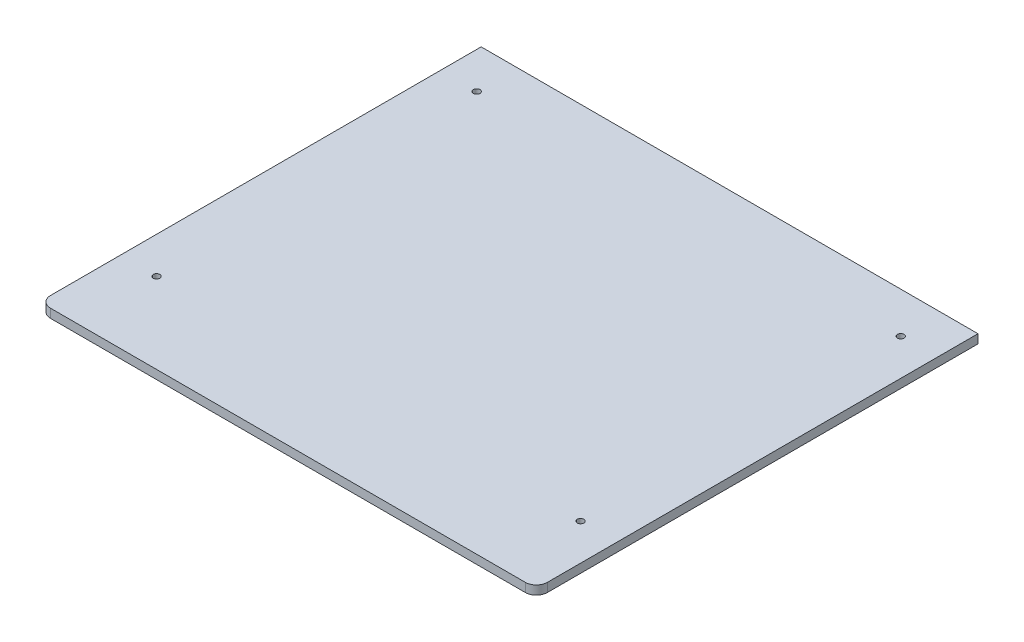
from build123d import *

# Parameters (mm, degrees)
SKETCH1_W      = 450
SKETCH1_H      = 400
EXTRUDE1_DEPTH = 8
SKETCH2_R      = 3
EXTRUDE2_DEPTH = 603.132875701
FILLET1_R      = 10


with BuildPart() as part:
    # Sketch1 → Extrude1 (new body)
    with BuildSketch(Plane(origin=(0, 0, 0), x_dir=(1, 0, 0), z_dir=(0, 1, 0))):
        with Locations((225, -200)):
            Rectangle(SKETCH1_W, SKETCH1_H)
    extrude(amount=EXTRUDE1_DEPTH)

    # Sketch2 → Extrude2 (cut, through all)
    with BuildSketch(Plane(origin=(0, 8, 0), x_dir=(-1, 0, 0), z_dir=(0, 1, 0))):
        with Locations(Location((-33, 37, 0), (0, 0, 90))):
            Circle(SKETCH2_R)
        with Locations(Location((-33, 327, 0), (0, 0, 90))):
            Circle(SKETCH2_R)
        with Locations(Location((-417, 37, 0), (0, 0, 90))):
            Circle(SKETCH2_R)
        with Locations(Location((-417, 327, 0), (0, 0, 90))):
            Circle(SKETCH2_R)
    extrude(amount=-EXTRUDE2_DEPTH, mode=Mode.SUBTRACT)

    # Fillet1
    fillet1_edges = [part.edges().sort_by_distance(p)[0] for p in [
        (450, 4, 400),
        (0, 4, 400),
    ]]
    fillet(fillet1_edges, radius=FILLET1_R)


solid = part.part
